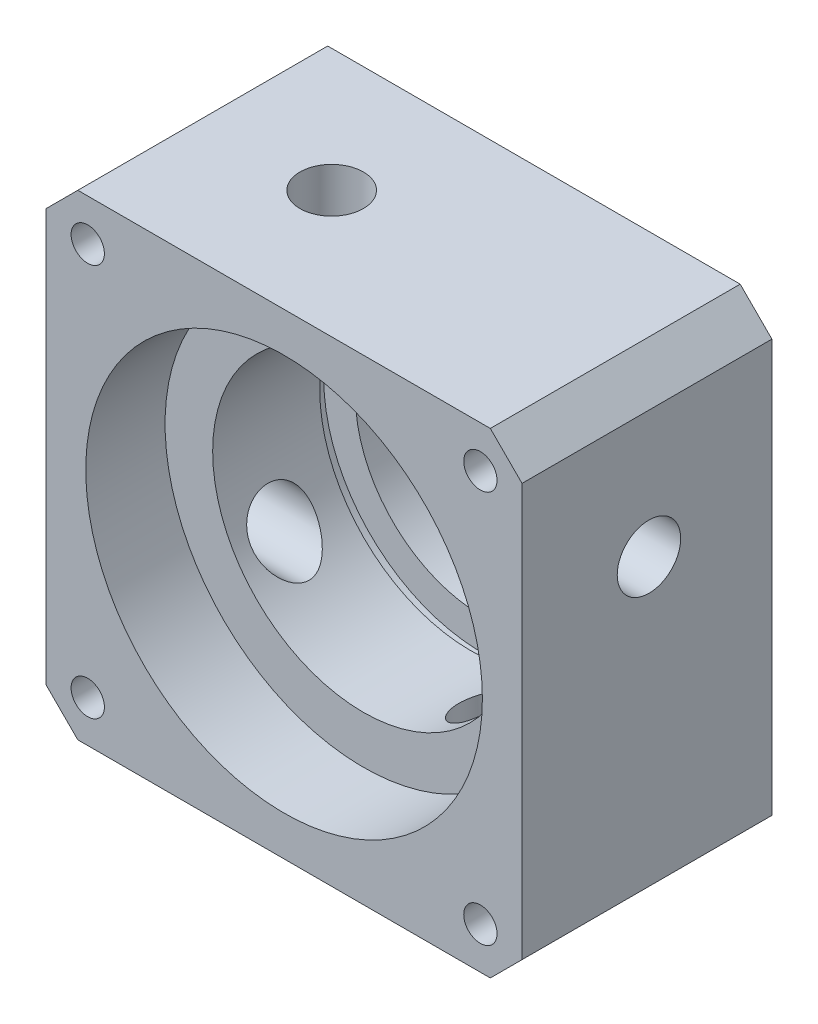
from build123d import *

# Parameters (mm, degrees)
SKETCH_1_R               = 19
EXTRUDE_1_DEPTH          = 31.5
SKETCH_2_R               = 25
CUT_EXTRUDE_1_DEPTH      = 10
PATTERN_CIRCULAR_1_COUNT = 4
SKETCH_6_R               = 19
SKETCH_6_R_2             = 16
EXTRUDE_2_DEPTH          = 8
SKETCH_7_R               = 20
CUT_EXTRUDE_2_DEPTH      = 1.5
SKETCH_9_R               = 4
CUT_EXTRUDE_3_DEPTH      = 20
PATTERN_CIRCULAR_2_COUNT = 4


with BuildPart() as part:
    # 草图1 → 凸台-拉伸1 (new body)
    with BuildSketch(Plane.XY):
        Polygon((30, 26), (26, 30), (-26, 30), (-30, 26), (-30, -26), (-26, -30), (26, -30), (30, -26), align=None)
        Circle(SKETCH_1_R, mode=Mode.SUBTRACT)
    extrude(amount=EXTRUDE_1_DEPTH)

    # 草图2 → 切除-拉伸1 (cut)
    with BuildSketch(Plane.XY.offset(31.5)):
        Circle(SKETCH_2_R)
    extrude(amount=-CUT_EXTRUDE_1_DEPTH, mode=Mode.SUBTRACT)

    # 草图4 → M5 螺纹孔1 (revolve, cut)
    with BuildSketch(Plane(origin=(24.748737342, 24.748737342, 31.5), x_dir=(0, -1, 0), z_dir=(1, 0, 0))):
        Polygon((0, 0), (0, 15.2618073), (2.1, 14), (2.1, 0), align=None)
    hole_wizard_m5_1 = revolve(axis=Axis((24.748737342, 24.748737342, 37.85), (0, 0, -1)), mode=Mode.SUBTRACT)

    # 阵列(圆周)1: M5 螺纹孔1 ×4 about axis
    pattern_circular_1_axis = Axis((0, 0, 0), (0, 0, 1))
    for i in range(1, PATTERN_CIRCULAR_1_COUNT):
        add(hole_wizard_m5_1.rotate(pattern_circular_1_axis, i * 360 / PATTERN_CIRCULAR_1_COUNT), mode=Mode.SUBTRACT)

    # 草图6 → 凸台-拉伸2 (add)
    with BuildSketch(Plane(origin=(0, 0, 0), x_dir=(-1, 0, 0), z_dir=(0, 0, -1))):
        Circle(SKETCH_6_R)
        Circle(SKETCH_6_R_2, mode=Mode.SUBTRACT)
    extrude(amount=-EXTRUDE_2_DEPTH)

    # 草图7 → 切除-拉伸2 (cut)
    with BuildSketch(Plane.XY.offset(8)):
        Circle(SKETCH_7_R)
    extrude(amount=-CUT_EXTRUDE_2_DEPTH, mode=Mode.SUBTRACT)

    # 草图9 → 切除-拉伸3 (cut)
    with BuildSketch(Plane(origin=(0, 30, 0), x_dir=(1, 0, 0), z_dir=(0, 1, 0))):
        with Locations(Location((-10, -15.5, 0), (0, 0, 270))):
            Circle(SKETCH_9_R)
    cut_extrude_3 = extrude(amount=-CUT_EXTRUDE_3_DEPTH, mode=Mode.SUBTRACT)

    # 阵列(圆周)2: 切除-拉伸3 ×4 about axis
    pattern_circular_2_axis = Axis((0, 0, 31.5), (0, 0, -1))
    for i in range(1, PATTERN_CIRCULAR_2_COUNT):
        add(cut_extrude_3.rotate(pattern_circular_2_axis, i * 360 / PATTERN_CIRCULAR_2_COUNT), mode=Mode.SUBTRACT)


solid = part.part
